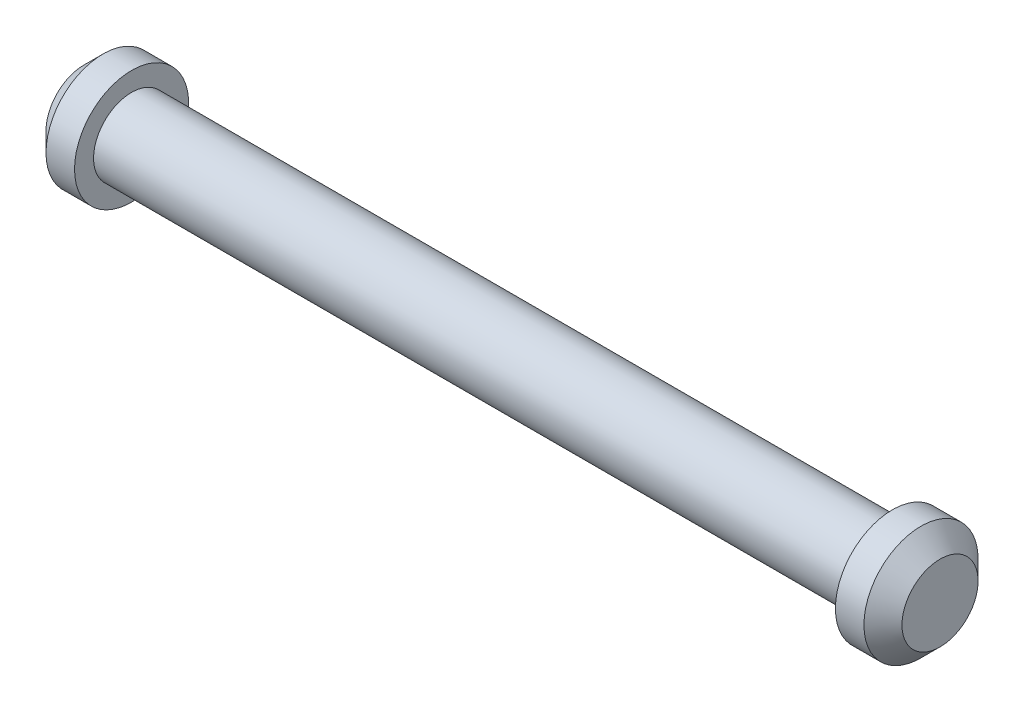
from build123d import *


with BuildPart() as part:
    # Sketch1 → Revolve1 (revolve)
    with BuildSketch(Plane.XY, mode=Mode.PRIVATE) as revolve1_sk:
        Polygon((-45, 0), (-45, 4), (-43, 6), (-40, 6), (-40, 4), (40, 4), (40, 6), (43, 6), (45, 4), (45, 0), align=None)
    revolve(revolve1_sk.sketch.rotate(Axis((-45, 0, 0), (1, 0, 0)), 90), axis=Axis((-45, 0, 0), (1, 0, 0)))


solid = part.part
